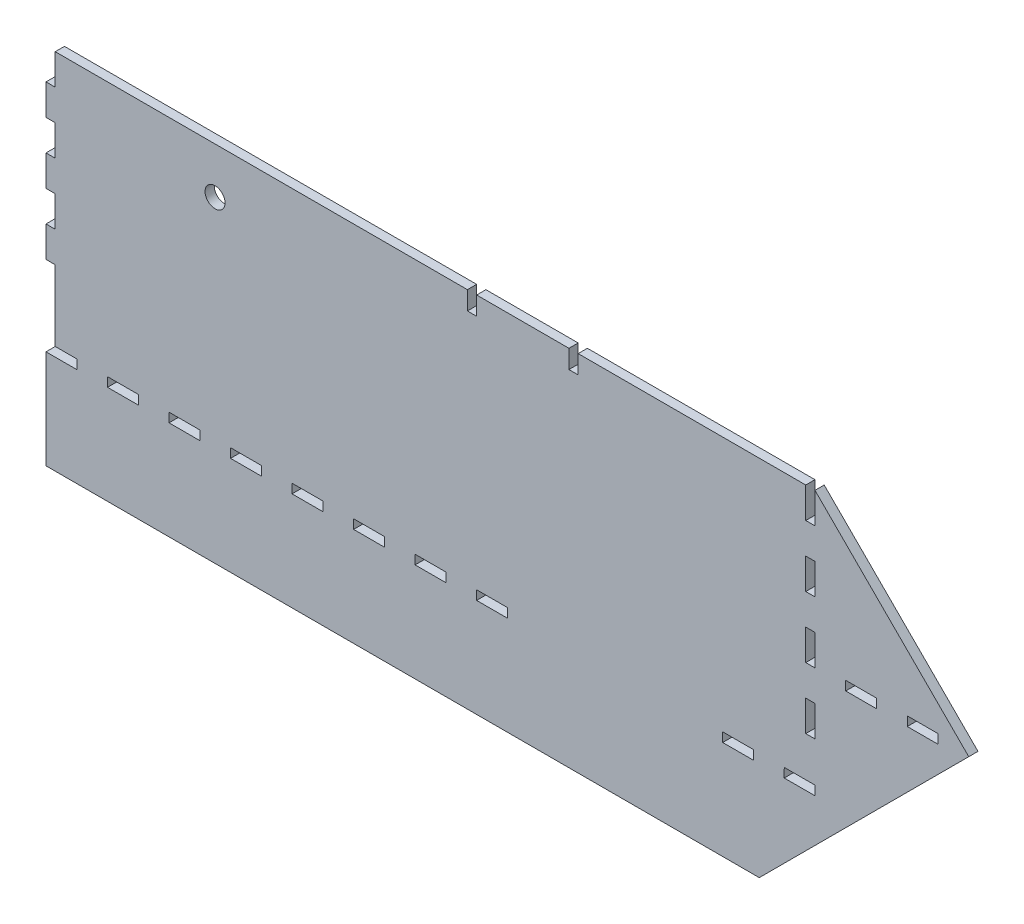
from build123d import *

# Parameters (mm, degrees)
SKETCH1_W           = 10
SKETCH1_H           = 3
SKETCH1_W_2         = 3
SKETCH1_H_2         = 10
SKETCH1_R           = 3.25
BOSS_EXTRUDE1_DEPTH = 3


with BuildPart() as part:
    # Sketch1 → Boss-Extrude1 (new body)
    with BuildSketch(Plane.XY):
        Polygon((-112.631023813, -53.728350242), (-112.631023813, -63.840272517), (-112.631023813, -85.840272517), (119.257053912, -85.840272517), (137.368976187, -67.728350242), (187.368976187, -17.728350242), (137.368976187, 32.271649758), (137.368976187, 22.271649758), (134.368976187, 22.271649758), (134.368976187, 32.271649758), (60.378976187, 32.271649758), (60.378976187, 26.271649758), (57.378976187, 26.271649758), (57.378976187, 32.271649758), (42.378976187, 32.271649758), (27.378976187, 32.271649758), (27.378976187, 26.271649758), (24.378976187, 26.271649758), (24.378976187, 32.271649758), (-62.631023813, 32.271649758), (-109.631023813, 32.271649758), (-109.631023813, 22.271649758), (-112.631023813, 22.271649758), (-112.631023813, 12.271649758), (-109.631023813, 12.271649758), (-109.631023813, 2.271649758), (-112.631023813, 2.271649758), (-112.631023813, -7.728350242), (-109.631023813, -7.728350242), (-109.631023813, -17.728350242), (-112.631023813, -17.728350242), (-112.631023813, -27.728350242), (-109.631023813, -27.728350242), (-109.631023813, -50.728350242), (-102.631023813, -50.728350242), (-102.631023813, -53.728350242), align=None)
        with Locations((-87.631023813, -52.228350242)):
            Rectangle(SKETCH1_W, SKETCH1_H, mode=Mode.SUBTRACT)
        with Locations((-67.631023813, -52.228350242)):
            Rectangle(SKETCH1_W, SKETCH1_H, mode=Mode.SUBTRACT)
        with Locations((-47.631023813, -52.228350242)):
            Rectangle(SKETCH1_W, SKETCH1_H, mode=Mode.SUBTRACT)
        with Locations((-27.631023813, -52.228350242)):
            Rectangle(SKETCH1_W, SKETCH1_H, mode=Mode.SUBTRACT)
        with Locations((-7.631023813, -52.228350242)):
            Rectangle(SKETCH1_W, SKETCH1_H, mode=Mode.SUBTRACT)
        with Locations((12.368976187, -52.228350242)):
            Rectangle(SKETCH1_W, SKETCH1_H, mode=Mode.SUBTRACT)
        Polygon((27.368976187, -50.728350242), (37.371405326, -50.728350242), (37.368976187, -53.728350242), (27.368976187, -53.728350242), align=None, mode=Mode.SUBTRACT)
        Polygon((107.3787447, -50.728350242), (117.381121881, -50.728350242), (117.369073889, -53.728350242), (107.369073889, -53.728350242), align=None, mode=Mode.SUBTRACT)
        Polygon((127.381202522, -50.728350242), (137.381202522, -50.728350242), (137.36915453, -53.728350242), (127.36915453, -53.728350242), align=None, mode=Mode.SUBTRACT)
        with Locations((135.868976187, -32.728350242)):
            Rectangle(SKETCH1_W_2, SKETCH1_H_2, mode=Mode.SUBTRACT)
        with Locations((-57.669534365, 17.271649758)):
            Circle(SKETCH1_R, mode=Mode.SUBTRACT)
        with Locations((135.868976187, -12.728350242)):
            Rectangle(SKETCH1_W_2, SKETCH1_H_2, mode=Mode.SUBTRACT)
        with Locations((152.368976187, -17.728350242)):
            Rectangle(SKETCH1_W, SKETCH1_H, mode=Mode.SUBTRACT)
        with Locations((172.368976187, -17.728350242)):
            Rectangle(SKETCH1_W, SKETCH1_H, mode=Mode.SUBTRACT)
        with Locations((135.868976187, 7.271649758)):
            Rectangle(SKETCH1_W_2, SKETCH1_H_2, mode=Mode.SUBTRACT)
    extrude(amount=BOSS_EXTRUDE1_DEPTH)


solid = part.part
